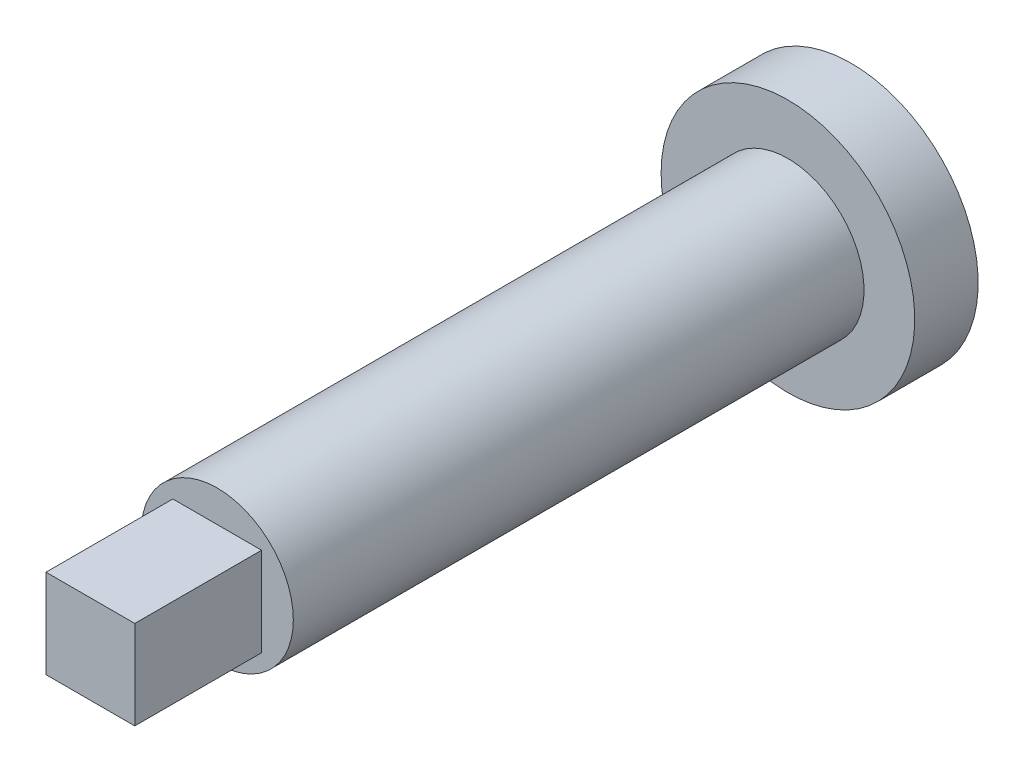
from build123d import *

# Parameters (mm, degrees)
SKETCH1_R           = 6
BOSS_EXTRUDE1_DEPTH = 50
SKETCH2_R           = 10
BOSS_EXTRUDE2_DEPTH = 5
SKETCH3_W           = 7
SKETCH3_H           = 7
BOSS_EXTRUDE3_DEPTH = 10


with BuildPart() as part:
    # Sketch1 → Boss-Extrude1 (new body)
    with BuildSketch(Plane.XY):
        Circle(SKETCH1_R)
    extrude(amount=BOSS_EXTRUDE1_DEPTH)

    # Sketch2 → Boss-Extrude2 (add)
    with BuildSketch(Plane(origin=(0, 0, 0), x_dir=(-1, 0, 0), z_dir=(0, 0, -1))):
        Circle(SKETCH2_R)
    extrude(amount=-BOSS_EXTRUDE2_DEPTH)

    # Sketch3 → Boss-Extrude3 (add)
    with BuildSketch(Plane.XY.offset(50)):
        Rectangle(SKETCH3_W, SKETCH3_H)
    extrude(amount=BOSS_EXTRUDE3_DEPTH)


solid = part.part
